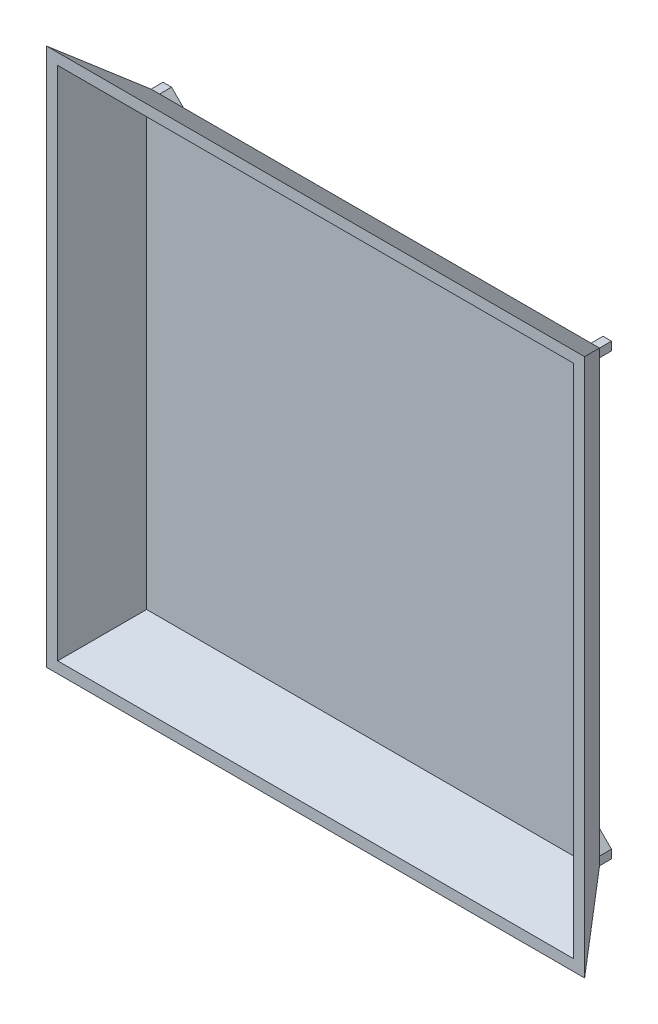
from build123d import *

# Parameters (mm, degrees)
SHELL_2_T           = -3
SKETCH_4_R          = 1.5
CUT_EXTRUDE_1_DEPTH = 10
EXTRUDE_1_DEPTH     = 40.5
CUT_EXTRUDE_2_DEPTH = 100
SKETCH_8_R          = 1.5
EXTRUDE_2_DEPTH     = 3
EXTRUDE_3_DEPTH     = 4
EXTRUDE_4_DEPTH     = 4
SKETCH_11_W         = 56.2
SKETCH_11_H         = 25
CUT_EXTRUDE_3_DEPTH = 4


with BuildPart() as part:
    # 草图3 → 放样1 section 0
    with BuildSketch(Plane.XY.offset(20)):
        with BuildLine():
            Line((-15, 15), (165, 15))
            Line((165, 15), (165, -165))
            Line((165, -165), (-15, -165))
            Line((-15, -165), (-15, 15))
        make_face()
    # 草图1 → 放样1 section 1
    with BuildSketch(Plane.XY):
        with BuildLine():
            Line((0, 0), (150, 0))
            Line((150, 0), (150, -150))
            Line((150, -150), (0, -150))
            Line((0, -150), (0, 0))
        make_face()
    loft()

    # 抽壳2
    shell_2_openings = [part.faces().sort_by_distance(p)[0] for p in [
        (75, -75, 20),
    ]]
    offset(amount=SHELL_2_T, openings=shell_2_openings, kind=Kind.INTERSECTION)

    # 草图4 → 切除-拉伸1 (cut)
    with BuildSketch(Plane.XY.offset(3)):
        with BuildLine():
            ThreePointArc((86.25, -75), (84.75, -73.5), (83.25, -75))
            Line((83.25, -75), (86.25, -75))
        make_face()
        with BuildLine():
            Line((86.25, -75), (83.25, -75))
            ThreePointArc((83.25, -75), (84.75, -76.5), (86.25, -75))
        make_face()
        with Locations((66.25, -82)):
            Circle(SKETCH_4_R)
        with BuildLine():
            ThreePointArc((74.75, -75), (73.25, -73.5), (71.75, -75))
            Line((71.75, -75), (74.75, -75))
        make_face()
        with BuildLine():
            Line((74.75, -75), (71.75, -75))
            ThreePointArc((71.75, -75), (73.25, -76.5), (74.75, -75))
        make_face()
        with Locations((66.25, -68)):
            Circle(SKETCH_4_R)
        with BuildLine():
            ThreePointArc((60.75, -75), (59.25, -73.5), (57.75, -75))
            Line((57.75, -75), (60.75, -75))
        make_face()
        with BuildLine():
            Line((60.75, -75), (57.75, -75))
            ThreePointArc((57.75, -75), (59.25, -76.5), (60.75, -75))
        make_face()
        with BuildLine():
            ThreePointArc((49.25, -75), (47.75, -73.5), (46.25, -75))
            Line((46.25, -75), (49.25, -75))
        make_face()
        with BuildLine():
            Line((49.25, -75), (46.25, -75))
            ThreePointArc((46.25, -75), (47.75, -76.5), (49.25, -75))
        make_face()
    extrude(amount=-CUT_EXTRUDE_1_DEPTH, mode=Mode.SUBTRACT)

    # 草图6 → 凸台-拉伸1 (add)
    with BuildSketch(Plane.XY.offset(3)):
        Polygon((38.15, -62.5), (34.15, -62.5), (31.15, -62.5), (31.15, -65.5), (34.15, -65.5), (34.15, -84.5), (31.15, -84.5), (31.15, -87.5), (34.15, -87.5), (38.15, -87.5), (38.15, -75), align=None)
        Polygon((94.35, -75), (94.35, -62.5), (98.35, -62.5), (101.35, -62.5), (101.35, -65.5), (98.35, -65.5), (98.35, -84.5), (101.35, -84.5), (101.35, -87.5), (98.35, -87.5), (94.35, -87.5), align=None)
    extrude(amount=-EXTRUDE_1_DEPTH)

    # 草图7 → 切除-拉伸2 (cut)
    with BuildSketch(Plane(origin=(98.35, 0, 0), x_dir=(0, 0, -1), z_dir=(1, 0, 0))):
        with BuildLine():
            ThreePointArc((18.01, -75), (16.5, -73.49), (14.99, -75))
            Line((14.99, -75), (16.5, -75))
            Line((16.5, -75), (18.01, -75))
        make_face()
        with BuildLine():
            Line((16.5, -75), (14.99, -75))
            ThreePointArc((14.99, -75), (16.5, -76.51), (18.01, -75))
            Line((18.01, -75), (16.5, -75))
        make_face()
        with BuildLine():
            ThreePointArc((35.01, -75), (33.5, -73.49), (31.99, -75))
            Line((31.99, -75), (33.5, -75))
            Line((33.5, -75), (35.01, -75))
        make_face()
        with BuildLine():
            Line((33.5, -75), (31.99, -75))
            ThreePointArc((31.99, -75), (33.5, -76.51), (35.01, -75))
            Line((35.01, -75), (33.5, -75))
        make_face()
    extrude(amount=-CUT_EXTRUDE_2_DEPTH, mode=Mode.SUBTRACT)

    # 草图8 → 凸台-拉伸2 (add)
    with BuildSketch(Plane.XY.offset(3)):
        with Locations((66.25, -68)):
            Circle(SKETCH_8_R)
        with Locations((59.25, -75)):
            Circle(SKETCH_8_R)
        with Locations((47.75, -75)):
            Circle(SKETCH_8_R)
        with Locations((73.25, -75)):
            Circle(SKETCH_8_R)
        with Locations((84.75, -75)):
            Circle(SKETCH_8_R)
        with Locations((66.25, -82)):
            Circle(SKETCH_8_R)
    extrude(amount=-EXTRUDE_2_DEPTH)

    # 草图9 → 凸台-拉伸3 (add)
    with BuildSketch(Plane(origin=(0, 0, 0), x_dir=(-1, 0, 0), z_dir=(0, 0, -1))):
        Polygon((-73.585786438, -76.414213562), (0, -2.828427125), (0, 0), (-2.828427125, 0), (-72.748638048, -69.920210924), (-150, -147.171572875), (-150, -150), (-147.171572875, -150), align=None)
    extrude(amount=EXTRUDE_3_DEPTH)

    # 草图10 → 凸台-拉伸4 (add)
    with BuildSketch(Plane(origin=(0, 0, 0), x_dir=(-1, 0, 0), z_dir=(0, 0, -1))):
        Polygon((-106.669297814, -40.502275062), (-147.171572875, 0), (-150, 0), (-150, -2.828427125), (-121.973814525, -30.8546126), (-2.828427125, -150), (0, -150), (0, -147.171572875), align=None)
    extrude(amount=EXTRUDE_4_DEPTH)

    # 草图11 → 切除-拉伸3 (cut)
    with BuildSketch(Plane(origin=(0, 0, -4), x_dir=(-1, 0, 0), z_dir=(0, 0, -1))):
        with Locations((-66.25, -75)):
            Rectangle(SKETCH_11_W, SKETCH_11_H)
    extrude(amount=-CUT_EXTRUDE_3_DEPTH, mode=Mode.SUBTRACT)


solid = part.part
